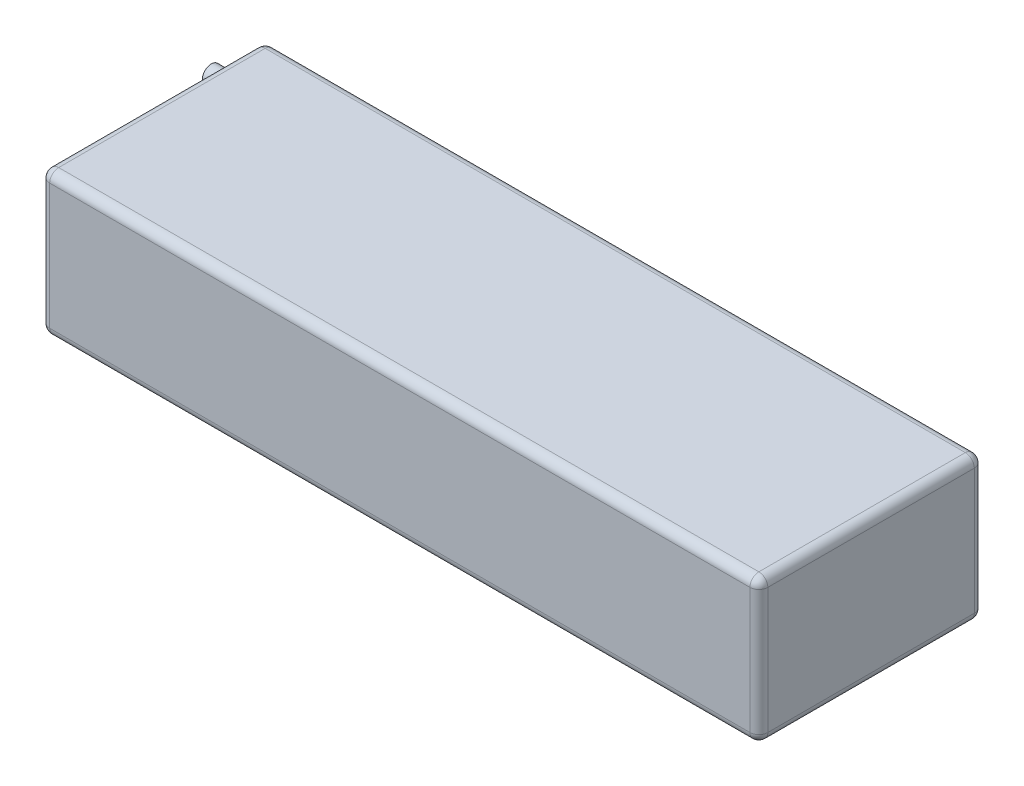
from build123d import *

# Parameters (mm, degrees)
SKETCH1_W           = 160
SKETCH1_H           = 50
BOSS_EXTRUDE1_DEPTH = 32
FILLET1_R           = 2
SKETCH2_R           = 2
BOSS_EXTRUDE2_DEPTH = 10


with BuildPart() as part:
    # Sketch1 → Boss-Extrude1 (new body)
    with BuildSketch(Plane(origin=(0, 0, 0), x_dir=(1, 0, 0), z_dir=(0, 1, 0))):
        Rectangle(SKETCH1_W, SKETCH1_H)
    extrude(amount=BOSS_EXTRUDE1_DEPTH)

    # Fillet1
    fillet1_edges = [part.edges().sort_by_distance(p)[0] for p in [
        (80, 32, 0),
        (0, 32, -25),
        (-80, 32, 0),
        (0, 0, -25),
        (80, 0, 0),
        (0, 0, 25),
        (-80, 0, 0),
        (0, 32, 25),
        (-80, 16, -25),
        (80, 16, -25),
        (80, 16, 25),
        (-80, 16, 25),
    ]]
    fillet(fillet1_edges, radius=FILLET1_R)

    # Sketch2 → Boss-Extrude2 (add, symmetric)
    with BuildSketch(Plane.ZY.offset(80)):
        with Locations(Location((-23, 21, 0), (0, 0, 180))):
            Circle(SKETCH2_R)
        with Locations(Location((-23, 16, 0), (0, 0, 180))):
            Circle(SKETCH2_R)
        with Locations(Location((-23, 11, 0), (0, 0, 180))):
            Circle(SKETCH2_R)
    extrude(amount=BOSS_EXTRUDE2_DEPTH, both=True)


solid = part.part
